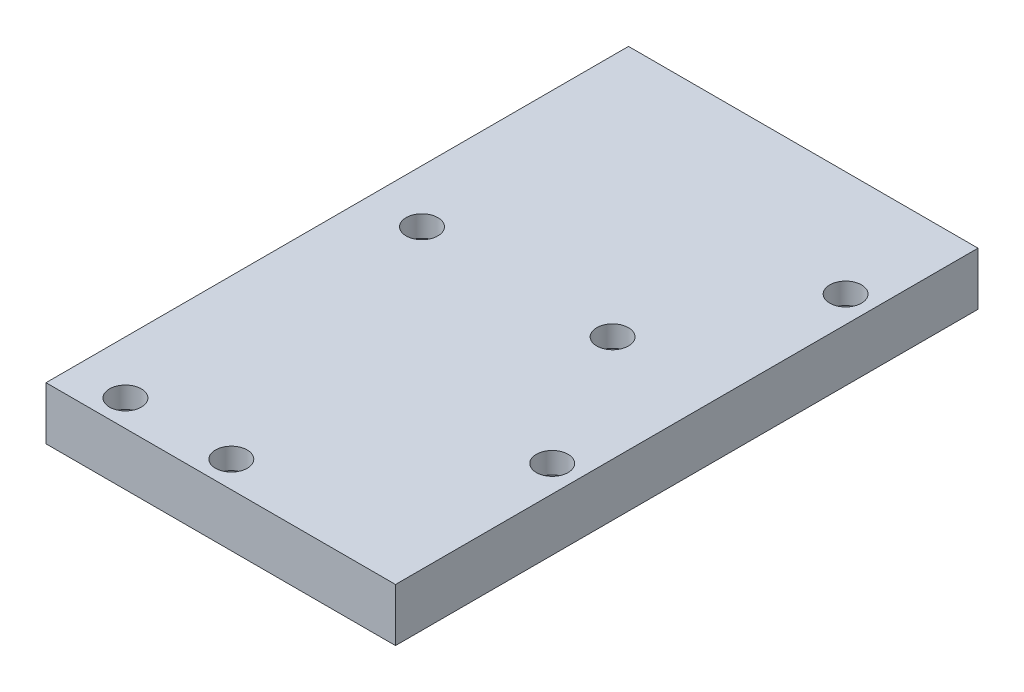
from build123d import *

# Parameters (mm, degrees)
SKETCH_1_W               = 28
SKETCH_1_H               = 55
SKETCH_1_R               = 1.5
EXTRUDE_1_DEPTH          = 5
CUT_EXTRUDE_1_DEPTH      = 62.919302322
CUT_EXTRUDE_1_DEPTH_BACK = 4
SKETCH_4_R               = 0.85
SKETCH_5_W               = 55
SKETCH_5_H               = 5
EXTRUDE_2_DEPTH          = 5
SKETCH_1_22_R            = 1.5
CUT_EXTRUDE_2_DEPTH      = 62.919302322
SKETCH_1_23_R            = 2.25
CUT_EXTRUDE_3_DEPTH      = 3


with BuildPart() as part:
    # 草图1 → 凸台-拉伸1 (new body)
    with BuildSketch(Plane(origin=(0, 0, 0), x_dir=(1, 0, 0), z_dir=(0, 1, 0))):
        with Locations((-14, -27.5)):
            Rectangle(SKETCH_1_W, SKETCH_1_H)
        with Locations(Location((-23, -24.5, 0), (0, 0, 270))):
            Circle(SKETCH_1_R, mode=Mode.SUBTRACT)
        with Locations(Location((-5, -24.5, 0), (0, 0, 270))):
            Circle(SKETCH_1_R, mode=Mode.SUBTRACT)
        with Locations(Location((-13, -52.5, 0), (0, 0, 270))):
            Circle(SKETCH_1_R, mode=Mode.SUBTRACT)
        with Locations(Location((-23, -52.5, 0), (0, 0, 270))):
            Circle(SKETCH_1_R, mode=Mode.SUBTRACT)
    extrude(amount=EXTRUDE_1_DEPTH)

    # 草图4 → 切除-拉伸1 (cut, two sides: drawn at the far end of the back side and taken through both)
    with BuildSketch(Plane.ZY.offset(28).offset(-CUT_EXTRUDE_1_DEPTH_BACK)):
        with Locations(Location((10, 2.5, 0), (0, 0, 180))):
            Circle(SKETCH_4_R)
        with Locations(Location((45, 2.5, 0), (0, 0, 180))):
            Circle(SKETCH_4_R)
    extrude(amount=CUT_EXTRUDE_1_DEPTH + CUT_EXTRUDE_1_DEPTH_BACK, mode=Mode.SUBTRACT)

    # 草图5 → 凸台-拉伸2 (add)
    with BuildSketch(Plane(origin=(0, 0, 0), x_dir=(0, 0, -1), z_dir=(1, 0, 0))):
        with Locations((-27.5, 2.5)):
            Rectangle(SKETCH_5_W, SKETCH_5_H)
    extrude(amount=EXTRUDE_2_DEPTH)

    # 草图1<22> → 切除-拉伸2 (cut, through all)
    with BuildSketch(Plane(origin=(0, 0, 0), x_dir=(1, 0, 0), z_dir=(0, 1, 0))):
        with Locations(Location((2.5, -37.701964887, 0), (0, 0, 270))):
            Circle(SKETCH_1_22_R)
        with Locations(Location((2.5, -10, 0), (0, 0, 270))):
            Circle(SKETCH_1_22_R)
    extrude(amount=CUT_EXTRUDE_2_DEPTH, mode=Mode.SUBTRACT)

    # 草图1<23> → 切除-拉伸3 (cut)
    with BuildSketch(Plane(origin=(0, 0, 0), x_dir=(1, 0, 0), z_dir=(0, 1, 0))):
        with Locations(Location((-23, -24.5, 0), (0, 0, 270))):
            Circle(SKETCH_1_23_R)
        with Locations(Location((-5, -24.5, 0), (0, 0, 270))):
            Circle(SKETCH_1_23_R)
        with Locations(Location((-13, -52.5, 0), (0, 0, 270))):
            Circle(SKETCH_1_23_R)
        with Locations(Location((2.5, -37.701964887, 0), (0, 0, 270))):
            Circle(SKETCH_1_23_R)
        with Locations(Location((-23, -52.5, 0), (0, 0, 270))):
            Circle(SKETCH_1_23_R)
        with Locations(Location((2.5, -10, 0), (0, 0, 270))):
            Circle(SKETCH_1_23_R)
    extrude(amount=CUT_EXTRUDE_3_DEPTH, mode=Mode.SUBTRACT)


solid = part.part
